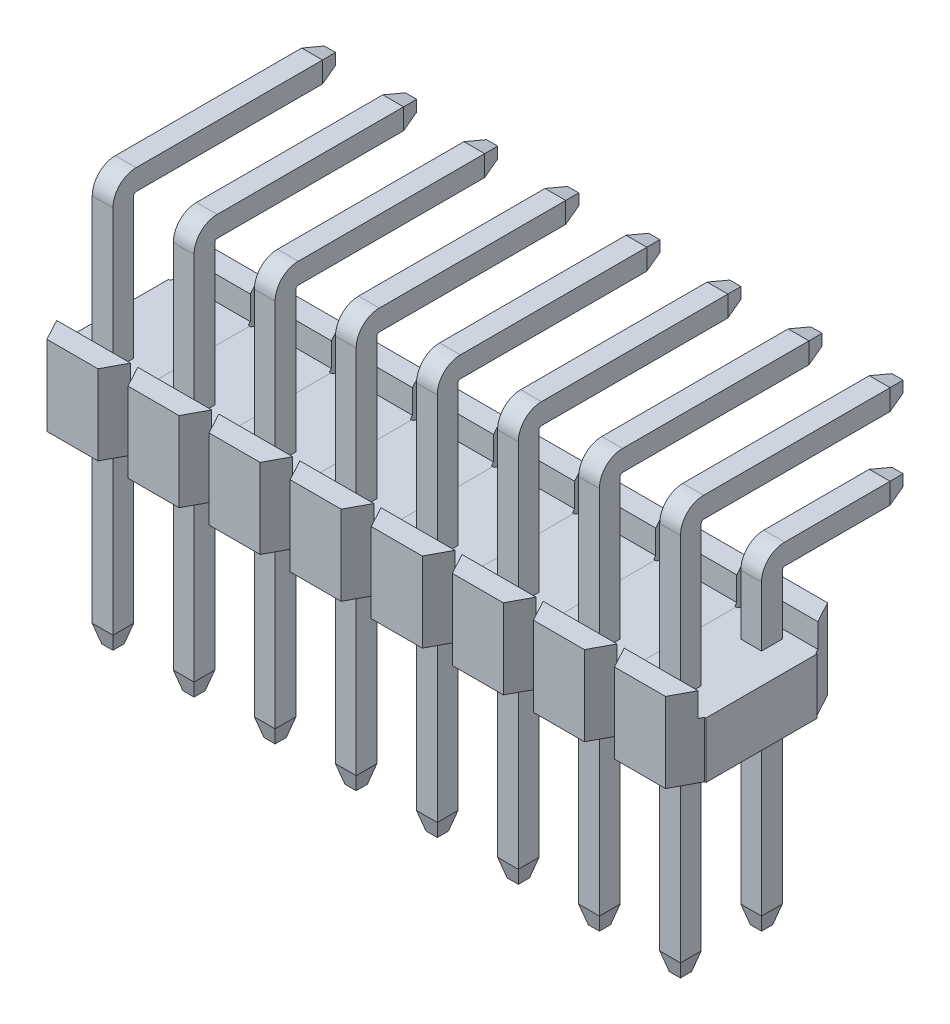
from build123d import *

# Parameters (mm, degrees)
EXTRUDE_START          = -4.06
EXTRUDE_2_DEPTH        = 2.5
CUT_EXTRUDE_START      = -4.06
SKETCH_6_W             = 2.54
SKETCH_6_H             = 3.75
CUT_EXTRUDE_1_DEPTH    = 0.75
SKETCH_2_W             = 0.65
SKETCH_2_H             = 0.65
SKETCH_4_W             = 0.65
SKETCH_4_H             = 0.65
CHAMFER_5_SIZE         = 0.15
CHAMFER_5_SIZE2        = 0.559807621
CHAMFER_6_SIZE         = 0.15
CHAMFER_6_SIZE2        = 0.559807621
CHAMFER_7_SIZE         = 0.15
CHAMFER_7_SIZE2        = 0.559807621
CHAMFER_8_SIZE         = 0.15
CHAMFER_8_SIZE2        = 0.559807621
PATTERN_LINEAR_1_COUNT = 8
PATTERN_LINEAR_1_PITCH = 2.54


with BuildPart() as part:
    # Эскиз1 → Бобышка-Вытянуть2 (new body)
    with BuildSketch(Plane(origin=(0, 0, 0), x_dir=(1, 0, 0), z_dir=(0, 1, 0)).offset(EXTRUDE_START)):
        Polygon((-0.8, -5.08), (0.8, -5.08), (1.23, -4.28), (1.27, -4.28), (1.27, -0.8), (1.23, -0.8), (0.8, 0), (-0.8, 0), (-1.23, -0.8), (-1.27, -0.8), (-1.27, -4.28), (-1.23, -4.28), align=None)
    extrude(amount=-EXTRUDE_2_DEPTH)

    # Эскиз6 → Вырез-Вытянуть1 (cut)
    with BuildSketch(Plane(origin=(0, 0, 0), x_dir=(1, 0, 0), z_dir=(0, 1, 0)).offset(CUT_EXTRUDE_START)):
        with Locations((0, -2.54)):
            Rectangle(SKETCH_6_W, SKETCH_6_H)
    extrude(amount=-CUT_EXTRUDE_1_DEPTH, mode=Mode.SUBTRACT)

    # По траектории7: sweep along a path in Эскиз3
    with BuildLine(Plane(origin=(0, 0, 0), x_dir=(0, 0, -1), z_dir=(1, 0, 0))) as sweep_7_path:
        Line((2.99, 0), (-3.41, 0))
        ThreePointArc((-3.41, 0), (-3.692842712, -0.117157288), (-3.81, -0.4))
        Line((-3.81, -0.4), (-3.81, -12.56))
    # Эскиз2 → По траектории7 (sweep)
    with BuildSketch(Plane(origin=(0, -12.56, 0), x_dir=(1, 0, 0), z_dir=(0, 1, 0))):
        with Locations((0, -3.81)):
            Rectangle(SKETCH_2_W, SKETCH_2_H)
    sweep(path=sweep_7_path.line)

    # По траектории8: sweep along a path in Эскиз5
    with BuildLine(Plane(origin=(0, 0, 0), x_dir=(0, 0, -1), z_dir=(1, 0, 0))) as sweep_8_path:
        Line((-1.27, -12.56), (-1.27, -2.94))
        ThreePointArc((-1.27, -2.94), (-1.152842712, -2.657157288), (-0.87, -2.54))
        Line((-0.87, -2.54), (2.99, -2.54))
    # Эскиз4 → По траектории8 (sweep)
    with BuildSketch(Plane(origin=(0, -12.56, 0), x_dir=(1, 0, 0), z_dir=(0, 1, 0))):
        with Locations((0, -1.27)):
            Rectangle(SKETCH_4_W, SKETCH_4_H)
    sweep(path=sweep_8_path.line)

    # Фаска5
    chamfer_5_edges = [part.edges().sort_by_distance(p)[0] for p in [
        (0, -2.215, -2.99),
        (0.325, -2.54, -2.99),
        (0, -2.865, -2.99),
        (-0.325, -2.54, -2.99),
    ]]
    chamfer_5_side = [part.faces().sort_by_distance(p)[0] for p in [
        (0, -2.54, -2.99),
    ]]
    chamfer(chamfer_5_edges, length=CHAMFER_5_SIZE, length2=CHAMFER_5_SIZE2, reference=chamfer_5_side[0])

    # Фаска6
    chamfer_6_edges = [part.edges().sort_by_distance(p)[0] for p in [
        (0.325, 0, -2.99),
        (0, -0.325, -2.99),
        (-0.325, 0, -2.99),
        (0, 0.325, -2.99),
    ]]
    chamfer_6_side = [part.faces().sort_by_distance(p)[0] for p in [
        (0, 0, -2.99),
    ]]
    chamfer(chamfer_6_edges, length=CHAMFER_6_SIZE, length2=CHAMFER_6_SIZE2, reference=chamfer_6_side[0])

    # Фаска7
    chamfer_7_edges = [part.edges().sort_by_distance(p)[0] for p in [
        (0.325, -12.56, 3.81),
        (0, -12.56, 3.485),
        (-0.325, -12.56, 3.81),
        (0, -12.56, 4.135),
    ]]
    chamfer_7_side = [part.faces().sort_by_distance(p)[0] for p in [
        (0, -12.56, 3.81),
    ]]
    chamfer(chamfer_7_edges, length=CHAMFER_7_SIZE, length2=CHAMFER_7_SIZE2, reference=chamfer_7_side[0])

    # Фаска8
    chamfer_8_edges = [part.edges().sort_by_distance(p)[0] for p in [
        (0, -12.56, 1.595),
        (0.325, -12.56, 1.27),
        (0, -12.56, 0.945),
        (-0.325, -12.56, 1.27),
    ]]
    chamfer_8_side = [part.faces().sort_by_distance(p)[0] for p in [
        (0, -12.56, 1.27),
    ]]
    chamfer(chamfer_8_edges, length=CHAMFER_8_SIZE, length2=CHAMFER_8_SIZE2, reference=chamfer_8_side[0])


with BuildPart() as pattern_linear_1_1:
    # Линейный массив1: pattern copy
    add(part.part.moved(Location(Vector(-1, 0, 0) * (1 * PATTERN_LINEAR_1_PITCH))))


with BuildPart() as pattern_linear_1_2:
    # Линейный массив1: pattern copy
    add(part.part.moved(Location(Vector(-1, 0, 0) * (2 * PATTERN_LINEAR_1_PITCH))))


with BuildPart() as pattern_linear_1_3:
    # Линейный массив1: pattern copy
    add(part.part.moved(Location(Vector(-1, 0, 0) * (3 * PATTERN_LINEAR_1_PITCH))))


with BuildPart() as pattern_linear_1_4:
    # Линейный массив1: pattern copy
    add(part.part.moved(Location(Vector(-1, 0, 0) * (4 * PATTERN_LINEAR_1_PITCH))))


with BuildPart() as pattern_linear_1_5:
    # Линейный массив1: pattern copy
    add(part.part.moved(Location(Vector(-1, 0, 0) * (5 * PATTERN_LINEAR_1_PITCH))))


with BuildPart() as pattern_linear_1_6:
    # Линейный массив1: pattern copy
    add(part.part.moved(Location(Vector(-1, 0, 0) * (6 * PATTERN_LINEAR_1_PITCH))))


with BuildPart() as pattern_linear_1_7:
    # Линейный массив1: pattern copy
    add(part.part.moved(Location(Vector(-1, 0, 0) * (7 * PATTERN_LINEAR_1_PITCH))))


solid = Compound([part.part, pattern_linear_1_1.part, pattern_linear_1_2.part, pattern_linear_1_3.part, pattern_linear_1_4.part, pattern_linear_1_5.part, pattern_linear_1_6.part, pattern_linear_1_7.part])
